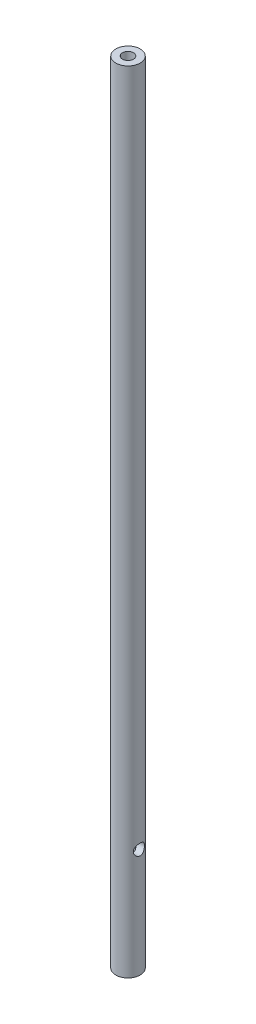
from build123d import *

# Parameters (mm, degrees)
SKETCH1_R               = 5.5
BOSS_EXTRUDE2_DEPTH     = 177.8
SKETCH4_R               = 2.5
CUT_EXTRUDE1_DEPTH      = 356.685057319
CUT_EXTRUDE3_REACH      = 180.559
CUT_EXTRUDE3_END_RADIUS = 2.5
SKETCH7_R               = 2.5


with BuildPart() as part:
    # Sketch1 → Boss-Extrude2 (new, symmetric)
    with BuildSketch(Plane(origin=(0, 0, 0), x_dir=(1, 0, 0), z_dir=(0, 1, 0))):
        with Locations(Location((0, 0, 0), (0, 0, 270))):
            Circle(SKETCH1_R)
    extrude(amount=BOSS_EXTRUDE2_DEPTH, both=True)

    # Sketch4 → Cut-Extrude1 (cut, through all)
    with BuildSketch(Plane(origin=(0, 177.8, 0), x_dir=(1, 0, 0), z_dir=(0, 1, 0))):
        with Locations(Location((0, 0, 0), (0, 0, 270))):
            Circle(SKETCH4_R)
    extrude(amount=-CUT_EXTRUDE1_DEPTH, mode=Mode.SUBTRACT)

    # Cut-Extrude3: up to this cylinder (the profile starts outside it)
    cut_extrude3_end = Plane(origin=(0, -128.8, 0), z_dir=(0, 1, 0)) * Cylinder(CUT_EXTRUDE3_END_RADIUS, 367.118, mode=Mode.PRIVATE)
    # Sketch7 → Cut-Extrude3 (cut, up to the surface)
    with BuildSketch(Plane(origin=(10, 0, 0), x_dir=(0, 0, -1), z_dir=(1, 0, 0)), mode=Mode.PRIVATE) as cut_extrude3_sk1:
        with Locations((0, -128.8)):
            Circle(SKETCH7_R)
    cut_extrude3_tool1 = extrude(cut_extrude3_sk1.sketch, amount=-CUT_EXTRUDE3_REACH, mode=Mode.PRIVATE) - cut_extrude3_end
    add(cut_extrude3_tool1.solids().sort_by_distance((10, -128.8, 0))[0], mode=Mode.SUBTRACT)


solid = part.part
